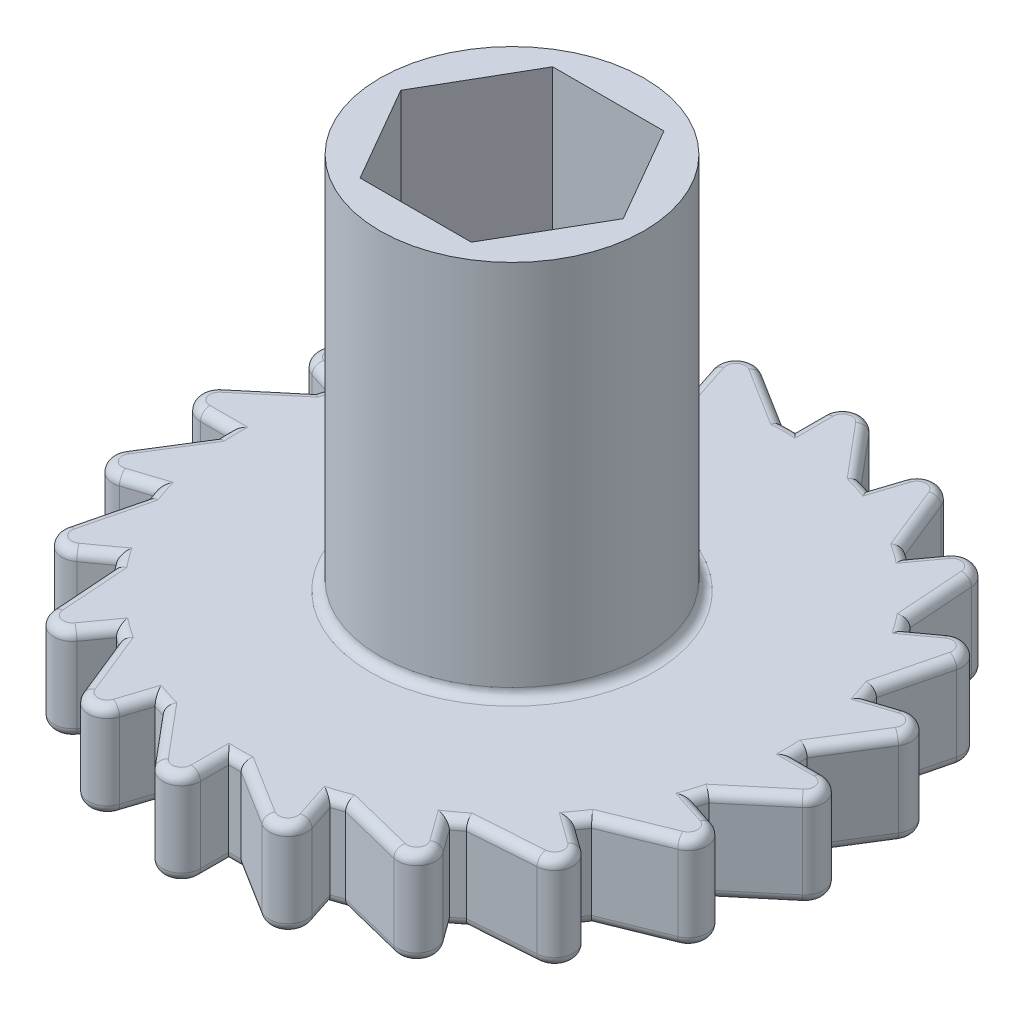
from build123d import *

# Parameters (mm, degrees)
SKETCH1_R                = 19.05
BOSS_EXTRUDE1_DEPTH      = 6.35
SKETCH2_R                = 8.89
BOSS_EXTRUDE2_DEPTH      = 25.4
BOSS_EXTRUDE4_DEPTH      = 6.35
FILLET2_R                = 1.27
CIRPATTERN2_COUNT        = 20
FILLET2_OF_CIRPATTERN2_R = 1.27
FILLET1_R                = 0.635


with BuildPart() as part:
    # Sketch1 → Boss-Extrude1 (new body)
    with BuildSketch(Plane(origin=(0, 0, 0), x_dir=(1, 0, 0), z_dir=(0, 1, 0))):
        with Locations(Location((0, 0, 0), (0, 0, 270))):
            Circle(SKETCH1_R)
        Polygon((7.478995387, 0), (3.739497694, 6.477), (-3.739497694, 6.477), (-7.478995387, 0), (-3.739497694, -6.477), (3.739497694, -6.477), align=None, mode=Mode.SUBTRACT)
    extrude(amount=BOSS_EXTRUDE1_DEPTH)

    # Sketch2 → Boss-Extrude2 (add)
    with BuildSketch(Plane(origin=(0, 6.35, 0), x_dir=(1, 0, 0), z_dir=(0, 1, 0))):
        with Locations(Location((0, 0, 0), (0, 0, 270))):
            Circle(SKETCH2_R)
        Polygon((3.739497694, 6.477), (-3.739497694, 6.477), (-7.478995387, 0), (-3.739497694, -6.477), (3.739497694, -6.477), (7.478995387, 0), align=None, mode=Mode.SUBTRACT)
    extrude(amount=BOSS_EXTRUDE2_DEPTH)

    # Sketch4 → Boss-Extrude4 (add)
    with BuildSketch(Plane.XZ):
        with BuildLine():
            Line((0, 19.05), (0, 24.438238667))
            Line((0, 24.438238667), (-5.106198641, 18.352908092))
            ThreePointArc((-5.106198641, 18.352908092), (-2.57678102, 18.874922505), (0, 19.05))
        make_face()
    boss_extrude4 = extrude(amount=-BOSS_EXTRUDE4_DEPTH)

    # Fillet2
    fillet2_edges = [part.edges().sort_by_distance(p)[0] for p in [
        (0, 3.175, 24.438238667),
    ]]
    fillet(fillet2_edges, radius=FILLET2_R)

    # CirPattern2: Boss-Extrude4 ×20 about axis
    cirpattern2_axis = Axis((0, 0, 0), (0, 1, 0))
    for i in range(1, CIRPATTERN2_COUNT):
        add(boss_extrude4.rotate(cirpattern2_axis, i * 360 / CIRPATTERN2_COUNT))

    # Fillet2 of CirPattern2
    fillet2_of_cirpattern2_edges = [part.edges().sort_by_distance(p)[0] for p in [
        (7.551831061, 3.175, 23.242146131),
        (14.364436281, 3.175, 19.770950394),
        (19.770950394, 3.175, 14.364436281),
        (23.242146131, 3.175, 7.551831061),
        (24.438238667, 3.175, 0),
        (23.242146131, 3.175, -7.551831061),
        (19.770950394, 3.175, -14.364436281),
        (14.364436281, 3.175, -19.770950394),
        (7.551831061, 3.175, -23.242146131),
        (0, 3.175, -24.438238667),
        (-7.551831061, 3.175, -23.242146131),
        (-14.364436281, 3.175, -19.770950394),
        (-19.770950394, 3.175, -14.364436281),
        (-23.242146131, 3.175, -7.551831061),
        (-24.438238667, 3.175, 0),
        (-23.242146131, 3.175, 7.551831061),
        (-19.770950394, 3.175, 14.364436281),
        (-14.364436281, 3.175, 19.770950394),
        (-7.551831061, 3.175, 23.242146131),
    ]]
    fillet(fillet2_of_cirpattern2_edges, radius=FILLET2_OF_CIRPATTERN2_R)

    # Fillet1
    fillet1_edges = [part.edges().sort_by_distance(p)[0] for p in [
        (18.387988006, 0, -8.817677103),
        (18.404712629, 0, -12.338905495),
        (0, 0, -6.477),
        (18.387988006, 6.35, -8.817677103),
        (18.404712629, 6.35, -12.338905495),
        (15.647844993, 6.35, 10.8649642),
        (-5.60924654, 0, -3.2385),
        (15.647844993, 0, 10.8649642),
        (16.179912057, 6.35, 11.755394209),
        (16.179912057, 0, 11.755394209),
        (-5.60924654, 0, 3.2385),
        (14.763203739, 0, -14.068310054),
        (13.690990386, 0, -17.422365454),
        (0, 0, 6.477),
        (14.763203739, 6.35, -14.068310054),
        (13.690990386, 6.35, -17.422365454),
        (18.239443528, 6.35, 5.497744974),
        (18.239443528, 0, 5.497744974),
        (9.693294229, 0, -17.941838797),
        (7.637098613, 0, -20.800402894),
        (19.020627381, 6.35, 6.180176471),
        (19.020627381, 0, 6.180176471),
        (9.693294229, 6.35, -17.941838797),
        (7.637098613, 6.35, -20.800402894),
        (3.674537542, 0, -20.05909535),
        (0.835634418, 0, -22.142351973),
        (19.045638248, 6.35, -0.407631836),
        (19.045638248, 0, -0.407631836),
        (3.674537542, 6.35, -20.05909535),
        (0.835634418, 6.35, -22.142351973),
        (19.999471172, 6.35, 0),
        (19.999471172, 0, 0),
        (-2.703908481, 0, -20.212827891),
        (-6.047627497, 0, -21.316853366),
        (-2.703908481, 6.35, -20.212827891),
        (-6.047627497, 6.35, -21.316853366),
        (17.987513198, 6.35, -6.273106801),
        (17.987513198, 0, -6.273106801),
        (19.020627381, 6.35, -6.180176471),
        (19.020627381, 0, -6.180176471),
        (-8.817677103, 0, -18.387988006),
        (-12.338905495, 0, -18.404712629),
        (-8.817677103, 6.35, -18.387988006),
        (-12.338905495, 6.35, -18.404712629),
        (15.16864503, 6.35, -11.524526365),
        (-14.068310054, 0, -14.763203739),
        (15.16864503, 0, -11.524526365),
        (-17.422365454, 0, -13.690990386),
        (16.179912057, 6.35, -11.755394209),
        (-14.068310054, 6.35, -14.763203739),
        (-17.422365454, 6.35, -13.690990386),
        (16.179912057, 0, -11.755394209),
        (-17.941838797, 0, -9.693294229),
        (-20.800402894, 0, -7.637098613),
        (-17.941838797, 6.35, -9.693294229),
        (-20.800402894, 6.35, -7.637098613),
        (10.8649642, 6.35, -15.647844993),
        (10.8649642, 0, -15.647844993),
        (11.755394209, 6.35, -16.179912057),
        (11.755394209, 0, -16.179912057),
        (-20.05909535, 0, -3.674537542),
        (-22.142351973, 0, -0.835634418),
        (-20.05909535, 6.35, -3.674537542),
        (-22.142351973, 6.35, -0.835634418),
        (5.497744974, 6.35, -18.239443528),
        (5.497744974, 0, -18.239443528),
        (-20.212827891, 0, 2.703908481),
        (-21.316853366, 0, 6.047627497),
        (6.180176471, 6.35, -19.020627381),
        (6.180176471, 0, -19.020627381),
        (-20.212827891, 6.35, 2.703908481),
        (-21.316853366, 6.35, 6.047627497),
        (0.407631836, 0, 19.045638248),
        (-18.387988006, 0, 8.817677103),
        (-18.404712629, 0, 12.338905495),
        (-0.407631836, 6.35, -19.045638248),
        (-0.407631836, 0, -19.045638248),
        (-18.387988006, 6.35, 8.817677103),
        (-18.404712629, 6.35, 12.338905495),
        (0, 6.35, -19.999471172),
        (0, 0, -19.999471172),
        (-14.763203739, 0, 14.068310054),
        (-13.690990386, 0, 17.422365454),
        (-14.763203739, 6.35, 14.068310054),
        (-13.690990386, 6.35, 17.422365454),
        (-6.273106801, 6.35, -17.987513198),
        (-6.273106801, 0, -17.987513198),
        (-6.180176471, 6.35, -19.020627381),
        (-6.180176471, 0, -19.020627381),
        (-9.693294229, 0, 17.941838797),
        (-7.637098613, 0, 20.800402894),
        (-9.693294229, 6.35, 17.941838797),
        (-7.637098613, 6.35, 20.800402894),
        (-11.524526365, 6.35, -15.16864503),
        (-11.524526365, 0, -15.16864503),
        (-11.755394209, 6.35, -16.179912057),
        (-11.755394209, 0, -16.179912057),
        (-15.647844993, 6.35, -10.8649642),
        (-15.647844993, 0, -10.8649642),
        (-16.179912057, 6.35, -11.755394209),
        (-16.179912057, 0, -11.755394209),
        (-18.239443528, 6.35, -5.497744974),
        (-18.239443528, 0, -5.497744974),
        (-19.020627381, 6.35, -6.180176471),
        (-19.020627381, 0, -6.180176471),
        (-19.045638248, 6.35, 0.407631836),
        (-19.045638248, 0, 0.407631836),
        (-19.999471172, 6.35, 0),
        (-19.999471172, 0, 0),
        (-17.987513198, 6.35, 6.273106801),
        (-17.987513198, 0, 6.273106801),
        (-19.020627381, 6.35, 6.180176471),
        (-19.020627381, 0, 6.180176471),
        (0, 6.35, -8.89),
        (-15.16864503, 6.35, 11.524526365),
        (-15.16864503, 0, 11.524526365),
        (-16.179912057, 6.35, 11.755394209),
        (-16.179912057, 0, 11.755394209),
        (-10.8649642, 6.35, 15.647844993),
        (-10.8649642, 0, 15.647844993),
        (-11.755394209, 6.35, 16.179912057),
        (-11.755394209, 0, 16.179912057),
        (-5.497744974, 6.35, 18.239443528),
        (-5.497744974, 0, 18.239443528),
        (-6.180176471, 6.35, 19.020627381),
        (-6.180176471, 0, 19.020627381),
        (2.703908481, 0, 20.212827891),
        (6.047627497, 0, 21.316853366),
        (2.703908481, 6.35, 20.212827891),
        (6.047627497, 6.35, 21.316853366),
        (0.407631836, 6.35, 19.045638248),
        (0, 6.35, 19.999471172),
        (8.817677103, 0, 18.387988006),
        (12.338905495, 0, 18.404712629),
        (0, 0, 19.999471172),
        (8.817677103, 6.35, 18.387988006),
        (12.338905495, 6.35, 18.404712629),
        (14.068310054, 0, 14.763203739),
        (17.422365454, 0, 13.690990386),
        (14.068310054, 6.35, 14.763203739),
        (17.422365454, 6.35, 13.690990386),
        (-3.674537542, 0, 20.05909535),
        (-0.835634418, 0, 22.142351973),
        (-3.674537542, 6.35, 20.05909535),
        (-0.835634418, 6.35, 22.142351973),
        (17.941838797, 0, 9.693294229),
        (20.800402894, 0, 7.637098613),
        (17.941838797, 6.35, 9.693294229),
        (20.800402894, 6.35, 7.637098613),
        (6.273106801, 0, 17.987513198),
        (6.273106801, 6.35, 17.987513198),
        (6.180176471, 6.35, 19.020627381),
        (6.180176471, 0, 19.020627381),
        (20.05909535, 0, 3.674537542),
        (22.142351973, 0, 0.835634418),
        (20.05909535, 6.35, 3.674537542),
        (22.142351973, 6.35, 0.835634418),
        (11.524526365, 6.35, 15.16864503),
        (20.212827891, 0, -2.703908481),
        (21.316853366, 0, -6.047627497),
        (11.524526365, 0, 15.16864503),
        (20.212827891, 6.35, -2.703908481),
        (21.316853366, 6.35, -6.047627497),
        (5.60924654, 0, 3.2385),
        (11.755394209, 6.35, 16.179912057),
        (11.755394209, 0, 16.179912057),
        (5.60924654, 0, -3.2385),
    ]]
    fillet(fillet1_edges, radius=FILLET1_R)


solid = part.part
